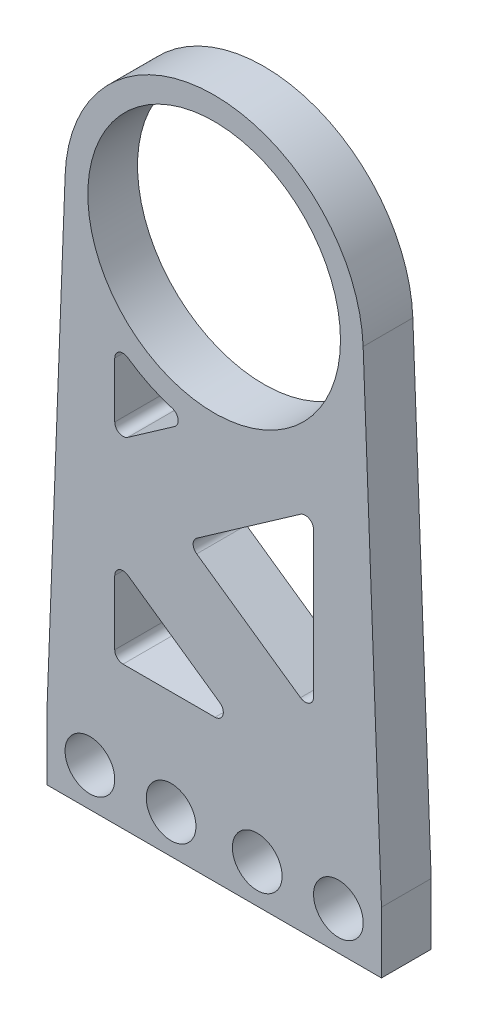
from build123d import *

# Parameters (mm, degrees)
SKETCH1_R               = 3
SKETCH1_R_2             = 7.95
MAIN_BODY_LINK_B1_DEPTH = 6
CUT_EXTRUDE1_REACH      = 169.025
CUT_EXTRUDE2_REACH      = 169.025
SKETCH3_R               = 1.5
FILLET1_R               = 1
SKETCH4_R               = 15.25
CUT_EXTRUDE3_DEPTH      = 168.02546447


with BuildPart() as part:
    # Sketch1 → Main Body Link B1 (new body)
    with BuildSketch(Plane.XY):
        with BuildLine():
            Line((-11.1, 83.474052381), (-9.1, 83.474052381))
            Line((-9.1, 83.474052381), (0, 83.474052381))
            Line((0, 83.474052381), (9.1, 83.474052381))
            Line((9.1, 83.474052381), (11.1, 83.474052381))
            Line((11.1, 83.474052381), (20.2, 83.474052381))
            Line((20.2, 83.474052381), (20.2, 90.874052381))
            Line((20.2, 90.874052381), (17.986683974, 148.383116621))
            ThreePointArc((17.986683974, 148.383116621), (0, 165.690874165), (-17.986683974, 148.383116621))
            Line((-17.986683974, 148.383116621), (-20.2, 90.874052381))
            Line((-20.2, 90.874052381), (-20.2, 83.474052381))
            Line((-20.2, 83.474052381), (-11.1, 83.474052381))
        make_face()
        with Locations((5.2, 88.124052381)):
            Circle(SKETCH1_R, mode=Mode.SUBTRACT)
        with Locations((15, 88.124052381)):
            Circle(SKETCH1_R, mode=Mode.SUBTRACT)
        with Locations((-15, 88.124052381)):
            Circle(SKETCH1_R, mode=Mode.SUBTRACT)
        with Locations((-5.2, 88.124052381)):
            Circle(SKETCH1_R, mode=Mode.SUBTRACT)
        with Locations((0, 147.690874165)):
            Circle(SKETCH1_R_2, mode=Mode.SUBTRACT)
    extrude(amount=MAIN_BODY_LINK_B1_DEPTH)

    # Sketch2 → Cut-Extrude1 (cut, up to next)
    with BuildSketch(Plane.XY.offset(6), mode=Mode.PRIVATE) as cut_extrude1_sk1:
        with BuildLine():
            ThreePointArc((-2.929911079, 129.930929878), (-7.774454217, 131.456408925), (-12, 134.2744663))
            Line((-12, 134.2744663), (-12, 123.584968066))
            Line((-12, 123.584968066), (-2.929911079, 129.930929878))
        make_face()
    cut_extrude1_tool1 = extrude(cut_extrude1_sk1.sketch, amount=-CUT_EXTRUDE1_REACH, mode=Mode.PRIVATE) & part.part
    # Sketch2 → Cut-Extrude1 (cut, up to next)
    with BuildSketch(Plane.XY.offset(6), mode=Mode.PRIVATE) as cut_extrude1_sk2:
        Polygon((-12, 111.380372399), (-12, 100.690874165), (3.278172542, 100.690874165), align=None)
    cut_extrude1_tool2 = extrude(cut_extrude1_sk2.sketch, amount=-CUT_EXTRUDE1_REACH, mode=Mode.PRIVATE) & part.part
    # Sketch2 → Cut-Extrude1 (cut, up to next)
    with BuildSketch(Plane.XY.offset(6), mode=Mode.PRIVATE) as cut_extrude1_sk3:
        Polygon((12, 106.793171999), (12, 128.172168466), (-3.278172542, 117.482670232), align=None)
    cut_extrude1_tool3 = extrude(cut_extrude1_sk3.sketch, amount=-CUT_EXTRUDE1_REACH, mode=Mode.PRIVATE) & part.part
    add(cut_extrude1_tool1.solids().sort_by_distance((-9.12997, 128.978342, 6))[0], mode=Mode.SUBTRACT)
    add(cut_extrude1_tool2.solids().sort_by_distance((-6.907276, 104.25404, 6))[0], mode=Mode.SUBTRACT)
    add(cut_extrude1_tool3.solids().sort_by_distance((6.907276, 117.48267, 6))[0], mode=Mode.SUBTRACT)

    # Sketch3 → Cut-Extrude2 (cut, up to next)
    with BuildSketch(Plane.XY.offset(6), mode=Mode.PRIVATE) as cut_extrude2_sk1:
        with Locations((-11.5, 147.690874165)):
            Circle(SKETCH3_R)
    cut_extrude2_tool1 = extrude(cut_extrude2_sk1.sketch, amount=-CUT_EXTRUDE2_REACH, mode=Mode.PRIVATE) & part.part
    # Sketch3 → Cut-Extrude2 (cut, up to next)
    with BuildSketch(Plane.XY.offset(6), mode=Mode.PRIVATE) as cut_extrude2_sk2:
        with Locations((11.5, 147.690874165)):
            Circle(SKETCH3_R)
    cut_extrude2_tool2 = extrude(cut_extrude2_sk2.sketch, amount=-CUT_EXTRUDE2_REACH, mode=Mode.PRIVATE) & part.part
    add(cut_extrude2_tool1.solids().sort_by_distance((-11.5, 147.690874, 6))[0], mode=Mode.SUBTRACT)
    add(cut_extrude2_tool2.solids().sort_by_distance((11.5, 147.690874, 6))[0], mode=Mode.SUBTRACT)

    # Fillet1
    fillet1_edges = [part.edges().sort_by_distance(p)[0] for p in [
        (-12, 100.690874165, 3),
        (3.278172542, 100.690874165, 3),
        (-12, 111.380372399, 3),
        (12, 106.793171999, 3),
        (12, 128.172168466, 3),
        (-3.278172542, 117.482670232, 3),
        (-12, 123.584968066, 3),
        (-2.929911079, 129.930929878, 3),
        (-12, 134.2744663, 3),
    ]]
    fillet(fillet1_edges, radius=FILLET1_R)

    # Sketch4 → Cut-Extrude3 (cut, through all)
    with BuildSketch(Plane.XY.offset(6)):
        with Locations((0, 147.690874165)):
            Circle(SKETCH4_R)
    extrude(amount=-CUT_EXTRUDE3_DEPTH, mode=Mode.SUBTRACT)


solid = part.part
